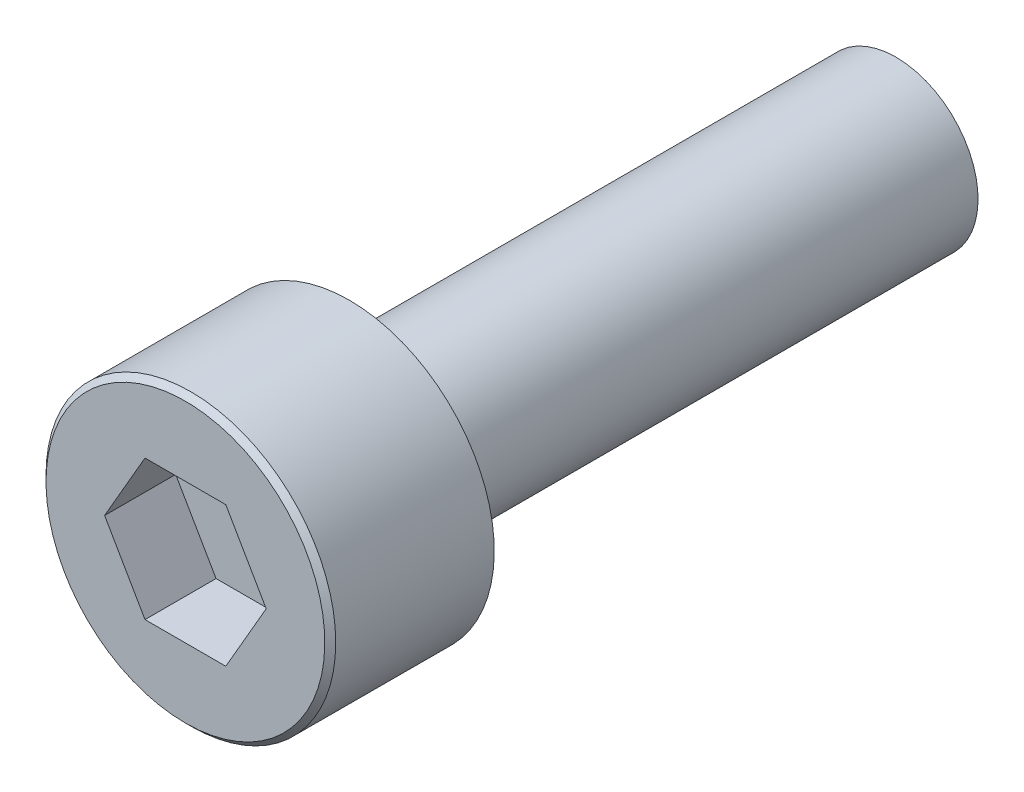
from build123d import *

# Parameters (mm, degrees)
CUT_EXTRUDE_1_DEPTH = 1.3
CHAMFER_623_SIZE    = 0.1


with BuildPart() as part:
    # 草图1 → 旋转1 (revolve)
    with BuildSketch(Plane(origin=(0, 0, 0), x_dir=(0, 0, -1), z_dir=(1, 0, 0))):
        Polygon((0, 0), (0, 2.65), (3, 2.65), (3, 1.5), (13, 1.5), (13, 0), align=None)
    revolve(axis=Axis((0, 0, -13), (0, 0, 1)))

    # 草图2 → 切除-拉伸1 (cut)
    with BuildSketch(Plane.XY):
        Polygon((0.739008345, 1.28), (-0.739008345, 1.28), (-1.478016689, 0), (-0.739008345, -1.28), (0.739008345, -1.28), (1.478016689, 0), align=None)
    extrude(amount=-CUT_EXTRUDE_1_DEPTH, mode=Mode.SUBTRACT)

    # Chamfer 623
    chamfer_623_edges = [part.edges().sort_by_distance(p)[0] for p in [
        (0, -2.65, 0),
    ]]
    chamfer(chamfer_623_edges, length=CHAMFER_623_SIZE)


solid = part.part
